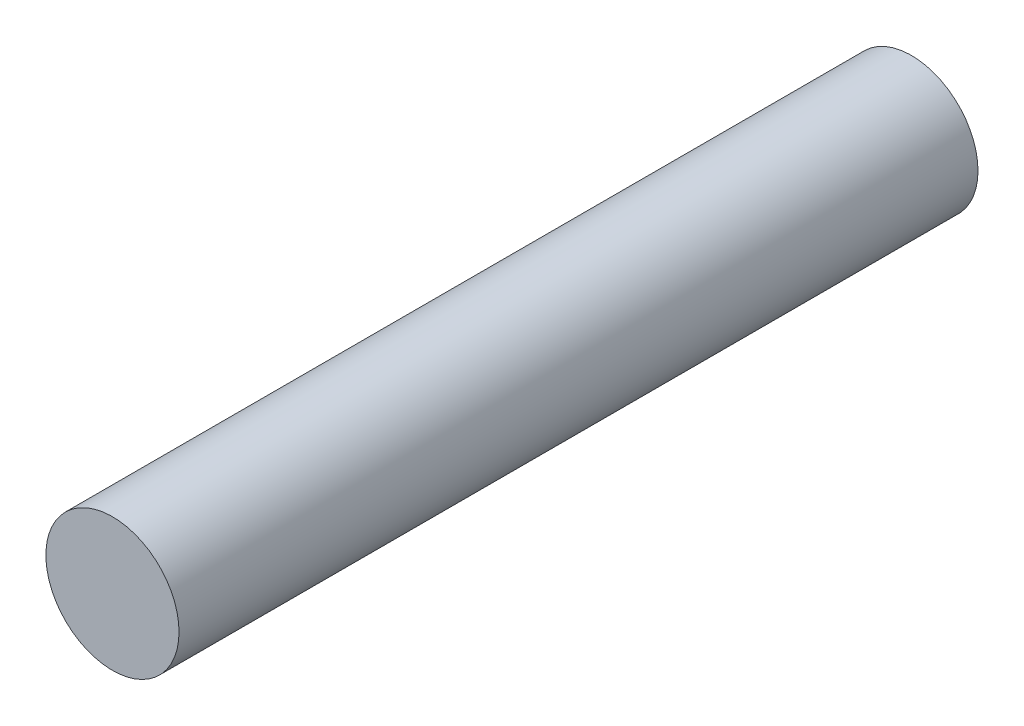
from build123d import *

# Parameters (mm, degrees)
SKETCH_1_R      = 25
EXTRUDE_1_DEPTH = 300


with BuildPart() as part:
    # 草图1 → 凸台-拉伸1 (new body)
    with BuildSketch(Plane.XY):
        Circle(SKETCH_1_R)
    extrude(amount=EXTRUDE_1_DEPTH)


solid = part.part
